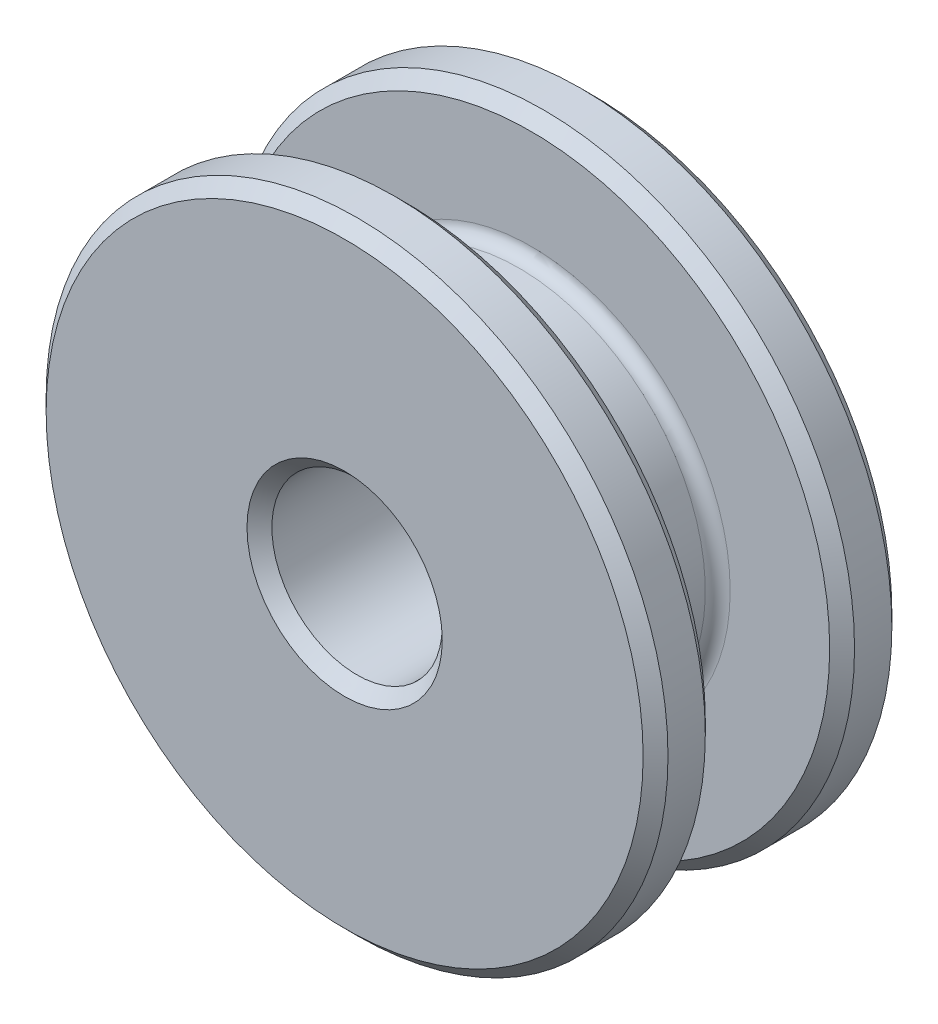
from build123d import *

# Parameters (mm, degrees)
SKETCH1_R           = 12.5
SKETCH1_R_2         = 3.425
BOSS_EXTRUDE1_DEPTH = 10
SKETCH2_W           = 5
SKETCH2_H           = 5
CHAMFER1_SIZE       = 0.5
FILLET1_R           = 0.5


with BuildPart() as part:
    # Sketch1 → Boss-Extrude1 (new body)
    with BuildSketch(Plane.XY):
        Circle(SKETCH1_R)
        Circle(SKETCH1_R_2, mode=Mode.SUBTRACT)
    extrude(amount=BOSS_EXTRUDE1_DEPTH)

    # Sketch2 → Cut-Revolve1 (revolve, cut)
    with BuildSketch(Plane(origin=(0, 0, 0), x_dir=(1, 0, 0), z_dir=(0, 1, 0))):
        with Locations((-10, -5)):
            Rectangle(SKETCH2_W, SKETCH2_H)
    revolve(axis=Axis((0, 0, 0), (0, 0, 1)), mode=Mode.SUBTRACT)

    # Chamfer1
    chamfer1_edges = [part.edges().sort_by_distance(p)[0] for p in [
        (-12.5, 0, 2.5),
        (-12.5, 0, 7.5),
        (-12.5, 0, 10),
        (-12.5, 0, 0),
        (-3.425, 0, 0),
        (-3.425, 0, 10),
    ]]
    chamfer(chamfer1_edges, length=CHAMFER1_SIZE)

    # Fillet1
    fillet1_edges = [part.edges().sort_by_distance(p)[0] for p in [
        (7.5, 0, 7.5),
        (7.5, 0, 2.5),
    ]]
    fillet(fillet1_edges, radius=FILLET1_R)


solid = part.part
